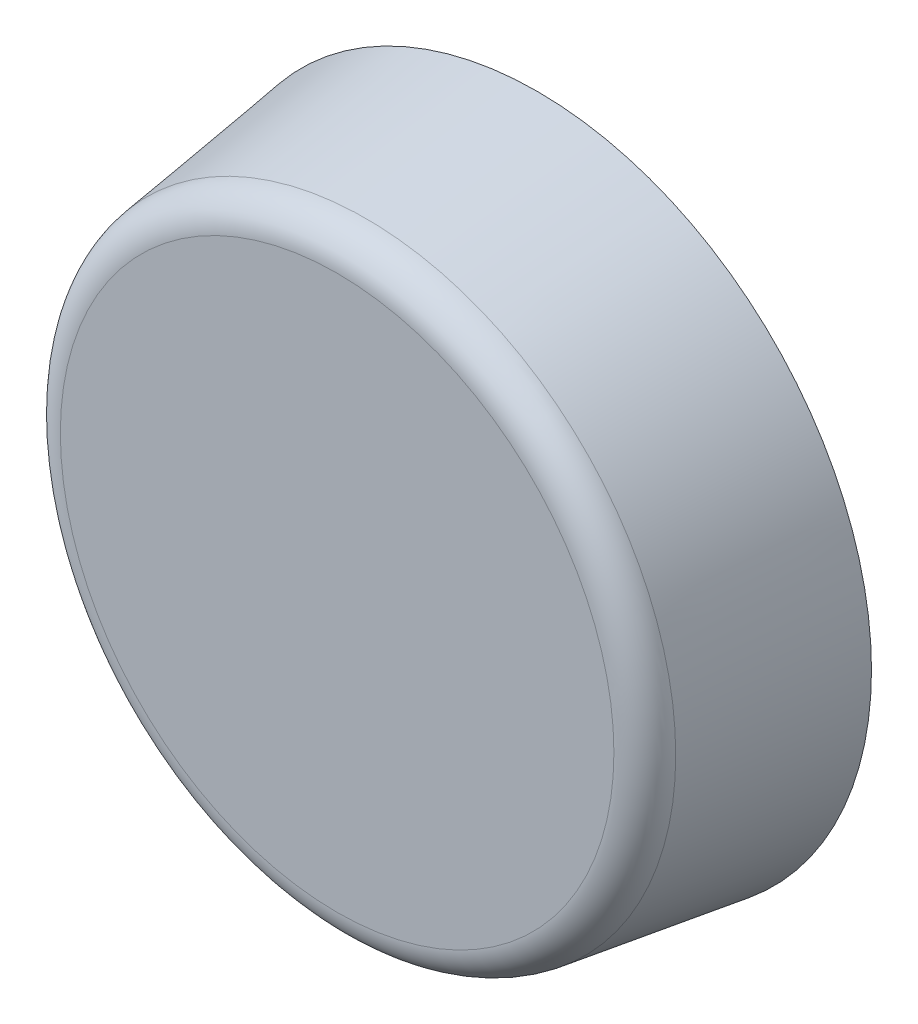
from build123d import *

# Parameters (mm, degrees)
ESQUISSE1_R        = 4.05
BOSS_EXTRU_1_DEPTH = 2
ESQUISSE2_R        = 10
BOSS_EXTRU_2_DEPTH = 6
BOSS_EXTRU_2_TAPER = 8
CONG_1_R           = 1


with BuildPart() as part:
    # Esquisse1 → Boss.-Extru.1 (new body)
    with BuildSketch(Plane.XY):
        Circle(ESQUISSE1_R)
    extrude(amount=BOSS_EXTRU_1_DEPTH)

    # Esquisse2 → Boss.-Extru.2 (add)
    with BuildSketch(Plane.XY.offset(2)):
        Circle(ESQUISSE2_R)
    extrude(amount=BOSS_EXTRU_2_DEPTH, taper=BOSS_EXTRU_2_TAPER)

    # Congé1
    cong_1_edges = [part.edges().sort_by_distance(p)[0] for p in [
        (-9.156754992, 0, 8),
    ]]
    fillet(cong_1_edges, radius=CONG_1_R)


solid = part.part
